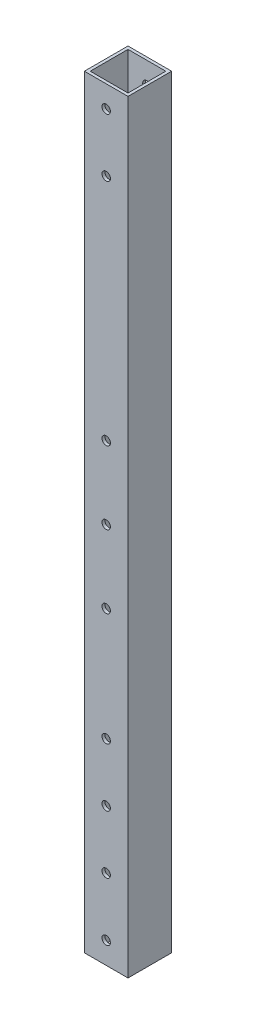
from build123d import *

# Parameters (mm, degrees)
SKETCH_1_W          = 15
SKETCH_1_H          = 15
SKETCH_1_W_2        = 13
SKETCH_1_H_2        = 13
EXTRUDE_1_DEPTH     = 262.5
SKETCH_2_R          = 1.45
CUT_EXTRUDE_1_DEPTH = 264.035168751


with BuildPart() as part:
    # 草图1 → 拉伸-薄壁1 (new body)
    with BuildSketch(Plane(origin=(0, 0, 0), x_dir=(1, 0, 0), z_dir=(0, 1, 0))):
        Rectangle(SKETCH_1_W, SKETCH_1_H)
        Rectangle(SKETCH_1_W_2, SKETCH_1_H_2, mode=Mode.SUBTRACT)
    extrude(amount=EXTRUDE_1_DEPTH)

    # 草图2 → 切除-拉伸1 (cut, through all)
    with BuildSketch(Plane.XY.offset(7.5)):
        with Locations((0, 7.5)):
            Circle(SKETCH_2_R)
        with Locations((0, 27.5)):
            Circle(SKETCH_2_R)
        with Locations(Location((0, 235, 0), (0, 0, 180))):
            Circle(SKETCH_2_R)
        with Locations(Location((0, 255, 0), (0, 0, 180))):
            Circle(SKETCH_2_R)
        with Locations((0, 131.25)):
            Circle(SKETCH_2_R)
        with Locations((0, 106.25)):
            Circle(SKETCH_2_R)
        with Locations((0, 156.25)):
            Circle(SKETCH_2_R)
        with Locations((0, 47.5)):
            Circle(SKETCH_2_R)
        with Locations((0, 67.5)):
            Circle(SKETCH_2_R)
    extrude(amount=-CUT_EXTRUDE_1_DEPTH, mode=Mode.SUBTRACT)


solid = part.part
